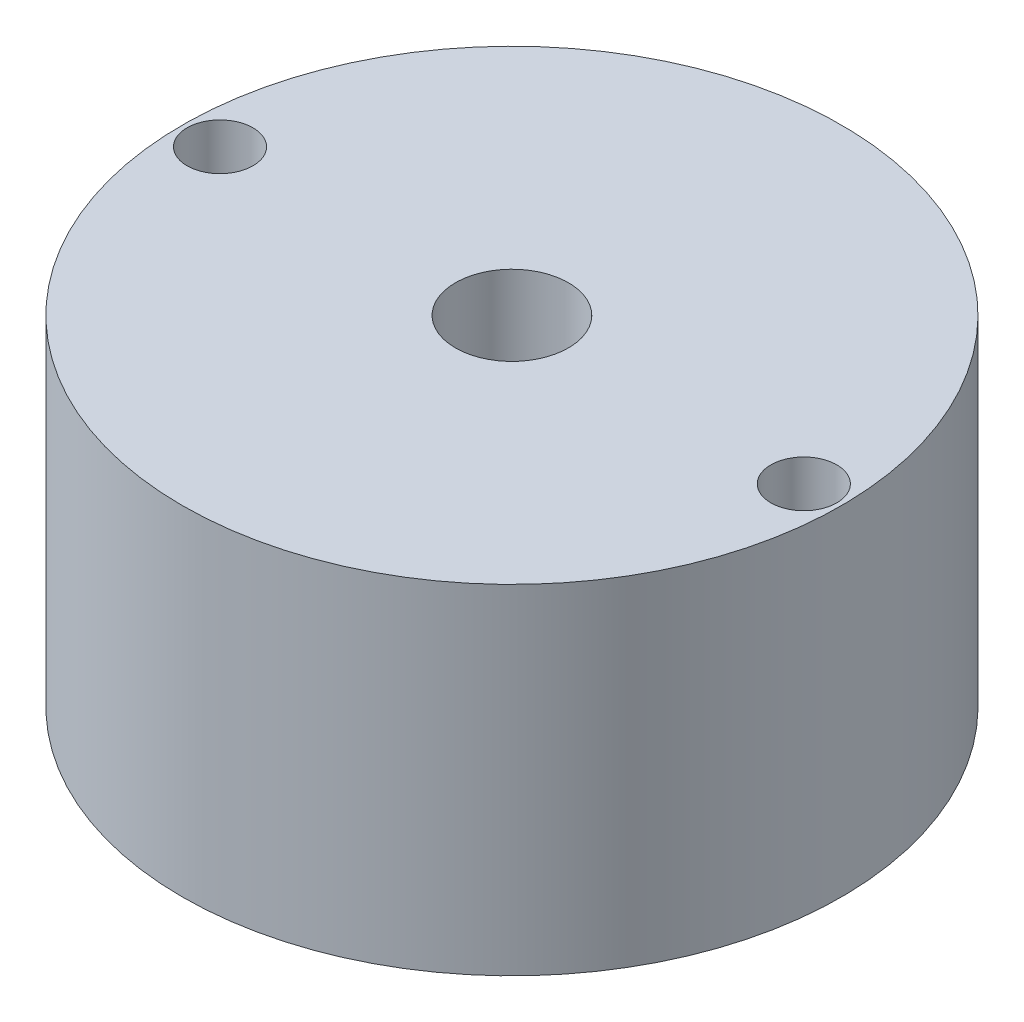
from build123d import *

# Parameters (mm, degrees)
SKETCH_1_R          = 17.5
EXTRUDE_1_DEPTH     = 18
SKETCH_2_R          = 3
CUT_EXTRUDE_1_DEPTH = 12
SKETCH_3_R          = 1.75
CUT_EXTRUDE_2_DEPTH = 8


with BuildPart() as part:
    # 草图1 → 凸台-拉伸1 (new body)
    with BuildSketch(Plane(origin=(0, 0, 0), x_dir=(1, 0, 0), z_dir=(0, 1, 0))):
        with Locations(Location((0, 0, 0), (0, 0, 270))):
            Circle(SKETCH_1_R)
    extrude(amount=EXTRUDE_1_DEPTH)

    # 草图2 → 切除-拉伸1 (cut)
    with BuildSketch(Plane(origin=(0, 18, 0), x_dir=(1, 0, 0), z_dir=(0, 1, 0))):
        with Locations(Location((0, 0, 0), (0, 0, 270))):
            Circle(SKETCH_2_R)
    extrude(amount=-CUT_EXTRUDE_1_DEPTH, mode=Mode.SUBTRACT)

    # 草图3 → 切除-拉伸2 (cut)
    with BuildSketch(Plane(origin=(0, 18, 0), x_dir=(1, 0, 0), z_dir=(0, 1, 0))):
        with Locations(Location((15.5, 0, 0), (0, 0, 270))):
            Circle(SKETCH_3_R)
        with Locations(Location((-15.5, 0, 0), (0, 0, 270))):
            Circle(SKETCH_3_R)
    extrude(amount=-CUT_EXTRUDE_2_DEPTH, mode=Mode.SUBTRACT)


solid = part.part
